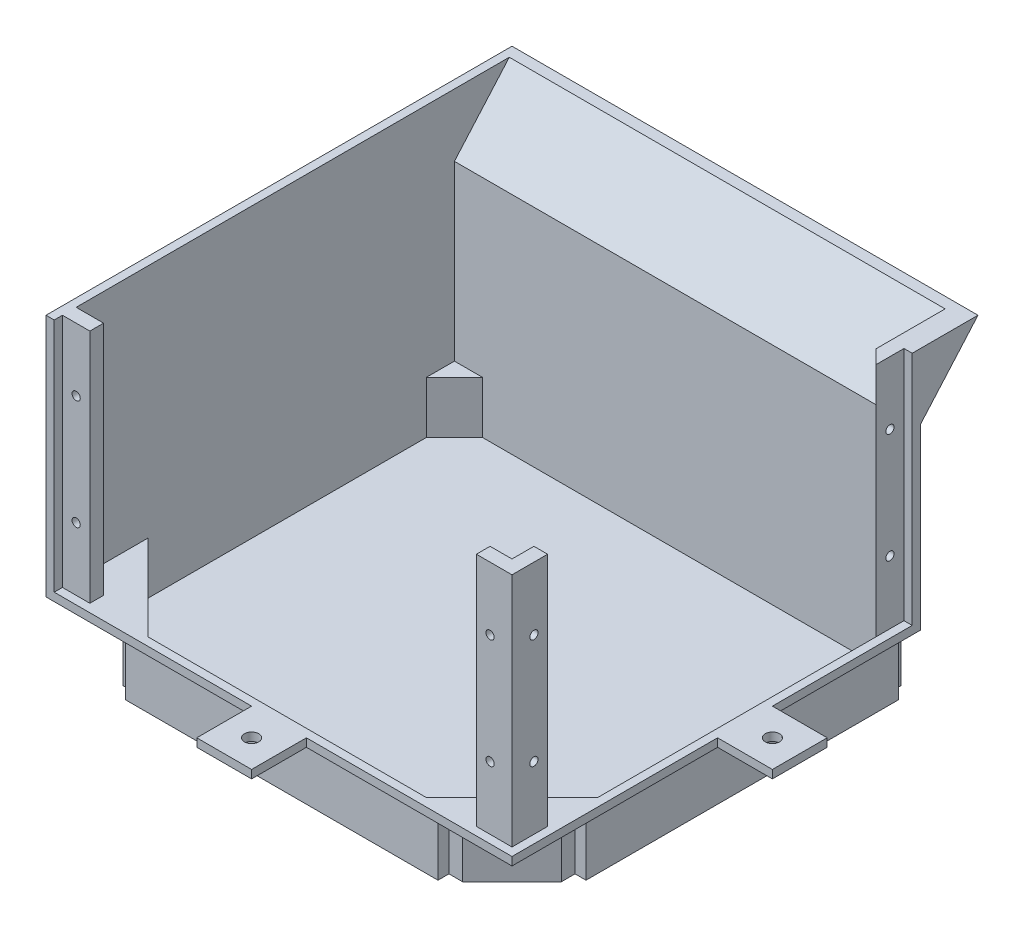
from build123d import *

# Parameters (mm, degrees)
EXTRUDE_1_DEPTH      = 4
EXTRUDE_2_DEPTH      = 16
SKETCH_3_W           = 170
SKETCH_3_H           = 170
CUT_EXTRUDE_2_DEPTH  = 1
EXTRUDE_3_DEPTH      = 3
EXTRUDE_4_DEPTH      = 86
SKETCH_7_W           = 10
SKETCH_7_H           = 3
SKETCH_7_W_2         = 3
SKETCH_7_H_2         = 10
EXTRUDE_6_DEPTH      = 86
SKETCH_8_R           = 1.5
CUT_EXTRUDE_3_DEPTH  = 86
SKETCH_9_R           = 1.606229087
SKETCH_9_R_2         = 2.055519853
CUT_EXTRUDE_4_DEPTH  = 86
SKETCH_10_W          = 3
SKETCH_10_H          = 3
EXTRUDE_7_DEPTH      = 86
SKETCH_11_R          = 1.5
CUT_EXTRUDE_5_DEPTH  = 86
EXTRUDE_8_DEPTH      = 86
SKETCH_13_R          = 1.5
CUT_EXTRUDE_6_DEPTH  = 86
SKETCH_14_R          = 3
CUT_EXTRUDE_7_DEPTH  = 2
SKETCH_15_R          = 1.5
CUT_EXTRUDE_8_DEPTH  = 5
SKETCH_16_R          = 3
CUT_EXTRUDE_9_DEPTH  = 2
SKETCH_17_W          = 10
SKETCH_17_H          = 2
SKETCH_17_W_2        = 2
SKETCH_17_H_2        = 10
EXTRUDE_9_DEPTH      = 86
SKETCH_18_R          = 3
CUT_EXTRUDE_10_DEPTH = 2
SKETCH_19_R          = 3
CUT_EXTRUDE_11_DEPTH = 2
SKETCH_22_W          = 20
SKETCH_22_H          = 20
SKETCH_22_R          = 2.6
EXTRUDE_10_DEPTH     = 3
SKETCH_23_W          = 170
SKETCH_23_H          = 20
CUT_EXTRUDE_12_DEPTH = 100
SKETCH_25_W          = 167
SKETCH_25_H          = 3
EXTRUDE_11_DEPTH     = 105
CUT_EXTRUDE_14_DEPTH = 19
SKETCH_28_W          = 114
SKETCH_28_H          = 1
SKETCH_28_W_2        = 1
SKETCH_28_H_2        = 114
CUT_EXTRUDE_15_DEPTH = 19
EXTRUDE_12_DEPTH     = 90
SKETCH_32_W          = 170
SKETCH_32_H          = 1
CUT_EXTRUDE_18_DEPTH = 100
CUT_EXTRUDE_19_DEPTH = 5
SKETCH_34_W          = 159
SKETCH_34_H          = 1
SKETCH_34_W_2        = 3
EXTRUDE_13_DEPTH     = 105
SKETCH_35_W          = 5
SKETCH_35_H          = 5
CUT_EXTRUDE_20_DEPTH = 16
SKETCH_36_W          = 2
SKETCH_36_H          = 1
CUT_EXTRUDE_21_DEPTH = 16
SKETCH_37_R          = 1.5
CUT_EXTRUDE_22_DEPTH = 16
SKETCH_38_R          = 3
CUT_EXTRUDE_23_DEPTH = 2
EXTRUDE_14_DEPTH     = 170
CUT_EXTRUDE_24_DEPTH = 167
EXTRUDE_15_DEPTH     = 8


with BuildPart() as part:
    # 草图1 → 凸台-拉伸1 (new body)
    with BuildSketch(Plane(origin=(0, 0, 0), x_dir=(1, 0, 0), z_dir=(0, 1, 0))):
        Polygon((-80, 62), (-62, 80), (-57, 80), (-57, 85), (57, 85), (57, 80), (62, 80), (80, 62), (80, 57), (85, 57), (85, -57), (80, -57), (80, -62), (62, -80), (57, -80), (57, -85), (-57, -85), (-57, -80), (-62, -80), (-80, -62), (-80, -57), (-85, -57), (-85, 57), (-80, 57), align=None)
    extrude(amount=EXTRUDE_1_DEPTH)

    # 草图2 → 凸台-拉伸2 (add)
    with BuildSketch(Plane(origin=(0, 4, 0), x_dir=(1, 0, 0), z_dir=(0, 1, 0))):
        Polygon((-57, 85), (57, 85), (57, 80), (62, 80), (80, 62), (80, 57), (85, 57), (85, -57), (80, -57), (80, -62), (62, -80), (57, -80), (57, -85), (-57, -85), (-57, -80), (-62, -80), (-80, -62), (-80, -57), (-85, -57), (-85, 57), (-80, 57), (-80, 62), (-62, 80), (-57, 80), align=None)
        Polygon((-82, 50.757359313), (-50.757359313, 82), (50.757359313, 82), (82, 50.757359313), (82, -50.757359313), (50.757359313, -82), (-50.757359313, -82), (-82, -50.757359313), align=None, mode=Mode.SUBTRACT)
    extrude(amount=EXTRUDE_2_DEPTH)

    # 草图3 → 切除-拉伸2 (cut)
    with BuildSketch(Plane(origin=(0, 0, 0), x_dir=(-1, 0, 0), z_dir=(0, -1, 0))):
        Rectangle(SKETCH_3_W, SKETCH_3_H)
    extrude(amount=-CUT_EXTRUDE_2_DEPTH, mode=Mode.SUBTRACT)

    # 草图4 → 凸台-拉伸3 (add)
    with BuildSketch(Plane(origin=(0, 20, 0), x_dir=(1, 0, 0), z_dir=(0, 1, 0))):
        Polygon((85, 85), (-57, 85), (-85, 85), (-85, -85), (57, -85), (85, -85), align=None)
        Polygon((82, 50.757359313), (82, -50.757359313), (50.757359313, -82), (-50.757359313, -82), (-82, -50.757359313), (-82, 50.757359313), (-50.757359313, 82), (50.757359313, 82), align=None, mode=Mode.SUBTRACT)
    extrude(amount=EXTRUDE_3_DEPTH)

    # 草图5 → 凸台-拉伸4 (add)
    with BuildSketch(Plane(origin=(0, 23, 0), x_dir=(1, 0, 0), z_dir=(0, 1, 0))):
        Polygon((85, 85), (-85, 85), (-85, -85), (-82, -85), (-82, 82), (85, 82), align=None)
    extrude(amount=EXTRUDE_4_DEPTH)

    # 草图7 → 凸台-拉伸6 (add)
    with BuildSketch(Plane(origin=(0, 23, 0), x_dir=(1, 0, 0), z_dir=(0, 1, 0))):
        with Locations((-77, -80.5)):
            Rectangle(SKETCH_7_W, SKETCH_7_H)
        with Locations((80.5, 77)):
            Rectangle(SKETCH_7_W_2, SKETCH_7_H_2)
        Polygon((72, -79), (72, -82), (82, -82), (82, -72), (79, -72), (79, -79), align=None)
    extrude(amount=EXTRUDE_6_DEPTH)

    # 草图8 → 切除-拉伸3 (cut)
    with BuildSketch(Plane.XY.offset(82)):
        with Locations((-77, 86)):
            Circle(SKETCH_8_R)
        with Locations((-77, 46)):
            Circle(SKETCH_8_R)
    extrude(amount=-CUT_EXTRUDE_3_DEPTH, mode=Mode.SUBTRACT)

    # 草图9 → 切除-拉伸4 (cut)
    with BuildSketch(Plane(origin=(82, 0, 0), x_dir=(0, 0, -1), z_dir=(1, 0, 0))):
        with Locations((77, 86)):
            Circle(SKETCH_9_R)
        with Locations((77, 46)):
            Circle(SKETCH_9_R_2)
    extrude(amount=-CUT_EXTRUDE_4_DEPTH, mode=Mode.SUBTRACT)

    # 草图10 → 凸台-拉伸7 (add)
    with BuildSketch(Plane(origin=(0, 109, 0), x_dir=(1, 0, 0), z_dir=(0, 1, 0))):
        with Locations((80.5, -70.5)):
            Rectangle(SKETCH_10_W, SKETCH_10_H)
        with Locations((70.5, -80.5)):
            Rectangle(SKETCH_10_W, SKETCH_10_H)
    extrude(amount=-EXTRUDE_7_DEPTH)

    # 草图11 → 切除-拉伸5 (cut)
    with BuildSketch(Plane.XY.offset(82)):
        with Locations((74, 86)):
            Circle(SKETCH_11_R)
        with Locations((74, 46)):
            Circle(SKETCH_11_R)
    extrude(amount=-CUT_EXTRUDE_5_DEPTH, mode=Mode.SUBTRACT)

    # 草图12 → 凸台-拉伸8 (add)
    with BuildSketch(Plane(origin=(0, 109, 0), x_dir=(1, 0, 0), z_dir=(0, 1, 0))):
        Polygon((69, -77), (69, -79), (79, -79), (79, -69), (77, -69), (77, -77), align=None)
    extrude(amount=-EXTRUDE_8_DEPTH)

    # 草图13 → 切除-拉伸6 (cut)
    with BuildSketch(Plane.XY.offset(82)):
        with Locations((74, 86)):
            Circle(SKETCH_13_R)
        with Locations((74, 46)):
            Circle(SKETCH_13_R)
    extrude(amount=-CUT_EXTRUDE_6_DEPTH, mode=Mode.SUBTRACT)

    # 草图14 → 切除-拉伸7 (cut)
    with BuildSketch(Plane(origin=(0, 0, 77), x_dir=(-1, 0, 0), z_dir=(0, 0, -1))):
        with Locations((-74, 86)):
            Circle(SKETCH_14_R)
        with Locations((-74, 46)):
            Circle(SKETCH_14_R)
    extrude(amount=-CUT_EXTRUDE_7_DEPTH, mode=Mode.SUBTRACT)

    # 草图15 → 切除-拉伸8 (cut)
    with BuildSketch(Plane(origin=(82, 0, 0), x_dir=(0, 0, -1), z_dir=(1, 0, 0))):
        with Locations((-74, 86)):
            Circle(SKETCH_15_R)
        with Locations((-74, 46)):
            Circle(SKETCH_15_R)
    extrude(amount=-CUT_EXTRUDE_8_DEPTH, mode=Mode.SUBTRACT)

    # 草图16 → 切除-拉伸9 (cut)
    with BuildSketch(Plane.ZY.offset(-77)):
        with Locations((74, 86)):
            Circle(SKETCH_16_R)
        with Locations((74, 46)):
            Circle(SKETCH_16_R)
    extrude(amount=-CUT_EXTRUDE_9_DEPTH, mode=Mode.SUBTRACT)

    # 草图17 → 凸台-拉伸9 (add)
    with BuildSketch(Plane(origin=(0, 109, 0), x_dir=(1, 0, 0), z_dir=(0, 1, 0))):
        with Locations((-77, -78)):
            Rectangle(SKETCH_17_W, SKETCH_17_H)
        with Locations((78, 77)):
            Rectangle(SKETCH_17_W_2, SKETCH_17_H_2)
    extrude(amount=-EXTRUDE_9_DEPTH)

    # 草图18 → 切除-拉伸10 (cut)
    with BuildSketch(Plane.ZY.offset(-77)):
        with Locations((-77, 86)):
            Circle(SKETCH_18_R)
        with Locations((-77, 46)):
            Circle(SKETCH_18_R)
    extrude(amount=-CUT_EXTRUDE_10_DEPTH, mode=Mode.SUBTRACT)

    # 草图19 → 切除-拉伸11 (cut)
    with BuildSketch(Plane(origin=(0, 0, 77), x_dir=(-1, 0, 0), z_dir=(0, 0, -1))):
        with Locations((77, 86)):
            Circle(SKETCH_19_R)
        with Locations((77, 46)):
            Circle(SKETCH_19_R)
    extrude(amount=-CUT_EXTRUDE_11_DEPTH, mode=Mode.SUBTRACT)

    # 草图22 → 凸台-拉伸10 (add)
    # profile 1 of 3: a face of its own
    with BuildSketch(Plane(origin=(0, 23, 0), x_dir=(1, 0, 0), z_dir=(0, 1, 0))):
        with Locations((-95, 10)):
            Rectangle(SKETCH_22_W, SKETCH_22_H)
        with Locations((-95, 10)):
            Circle(SKETCH_22_R, mode=Mode.SUBTRACT)
    # profile 2 of 3: a face of its own
    with BuildSketch(Plane(origin=(0, 23, 0), x_dir=(1, 0, 0), z_dir=(0, 1, 0))):
        with Locations((95, 0)):
            Rectangle(SKETCH_22_W, SKETCH_22_H)
        with Locations((95, 0)):
            Circle(SKETCH_22_R, mode=Mode.SUBTRACT)
    # profile 3 of 3: a face of its own
    with BuildSketch(Plane(origin=(0, 23, 0), x_dir=(1, 0, 0), z_dir=(0, 1, 0))):
        with Locations((0, -95)):
            Rectangle(SKETCH_22_W, SKETCH_22_H)
        with Locations((0, -95)):
            Circle(SKETCH_22_R, mode=Mode.SUBTRACT)
    extrude(amount=-EXTRUDE_10_DEPTH)

    # 草图23 → 切除-拉伸12 (cut)
    with BuildSketch(Plane(origin=(0, 109, 0), x_dir=(1, 0, 0), z_dir=(0, 1, 0))):
        with Locations((0, 75)):
            Rectangle(SKETCH_23_W, SKETCH_23_H)
    extrude(amount=-CUT_EXTRUDE_12_DEPTH, mode=Mode.SUBTRACT)

    # 草图25 → 凸台-拉伸11 (add)
    with BuildSketch(Plane(origin=(0, 4, 0), x_dir=(1, 0, 0), z_dir=(0, 1, 0))):
        with Locations((1.5, 63.5)):
            Rectangle(SKETCH_25_W, SKETCH_25_H)
    extrude(amount=EXTRUDE_11_DEPTH)

    # 草图26 → 切除-拉伸14 (cut)
    with BuildSketch(Plane.XZ.offset(-1)):
        Polygon((80, -65), (77, -65), (80, -62), (85, -62), (85, -65), align=None)
        Polygon((-82, -62), (-80, -62), (-77, -65), (-80, -65), (-82, -65), align=None)
    extrude(amount=-CUT_EXTRUDE_14_DEPTH, mode=Mode.SUBTRACT)

    # 草图28 → 切除-拉伸15 (cut)
    with BuildSketch(Plane.XZ.offset(-1)):
        with Locations((0, 84.5)):
            Rectangle(SKETCH_28_W, SKETCH_28_H)
        with Locations((84.5, 0)):
            Rectangle(SKETCH_28_W_2, SKETCH_28_H_2)
        with Locations((0, -84.5)):
            Rectangle(SKETCH_28_W, SKETCH_28_H)
        with Locations((-84.5, 0)):
            Rectangle(SKETCH_28_W_2, SKETCH_28_H_2)
    extrude(amount=-CUT_EXTRUDE_15_DEPTH, mode=Mode.SUBTRACT)

    # 草图29 → 凸台-拉伸12 (add)
    with BuildSketch(Plane(origin=(0, 109, 0), x_dir=(1, 0, 0), z_dir=(0, 1, 0))):
        Polygon((82, 50.757359313), (82, 62), (79, 62), (77, 62), (77, 55.757359313), (79, 53.757359313), align=None)
    extrude(amount=-EXTRUDE_12_DEPTH)

    # 草图32 → 切除-拉伸18 (cut)
    with BuildSketch(Plane(origin=(0, 109, 0), x_dir=(1, 0, 0), z_dir=(0, 1, 0))):
        with Locations((0, 64.5)):
            Rectangle(SKETCH_32_W, SKETCH_32_H)
    extrude(amount=-CUT_EXTRUDE_18_DEPTH, mode=Mode.SUBTRACT)

    # 草图33 → 切除-拉伸19 (cut)
    with BuildSketch(Plane(origin=(0, 9, 0), x_dir=(1, 0, 0), z_dir=(0, 1, 0))):
        Polygon((67.757359313, 65), (-67.757359313, 65), (-68.757359313, 64), (67.757359313, 64), (68.757359313, 64), align=None)
    extrude(amount=-CUT_EXTRUDE_19_DEPTH, mode=Mode.SUBTRACT)

    # 草图34 → 凸台-拉伸13 (add)
    with BuildSketch(Plane(origin=(0, 109, 0), x_dir=(1, 0, 0), z_dir=(0, 1, 0))):
        with Locations((-2.5, 61.5)):
            Rectangle(SKETCH_34_W, SKETCH_34_H)
        with Locations((83.5, 61.5)):
            Rectangle(SKETCH_34_W_2, SKETCH_34_H)
    extrude(amount=-EXTRUDE_13_DEPTH)

    # 草图35 → 切除-拉伸20 (cut)
    with BuildSketch(Plane(origin=(0, 4, 0), x_dir=(-1, 0, 0), z_dir=(0, -1, 0))):
        with Locations((-82.5, 59.5)):
            Rectangle(SKETCH_35_W, SKETCH_35_H)
    extrude(amount=-CUT_EXTRUDE_20_DEPTH, mode=Mode.SUBTRACT)

    # 草图36 → 切除-拉伸21 (cut)
    with BuildSketch(Plane.XZ.offset(-4)):
        with Locations((-81, -61.5)):
            Rectangle(SKETCH_36_W, SKETCH_36_H)
    extrude(amount=-CUT_EXTRUDE_21_DEPTH, mode=Mode.SUBTRACT)

    # 草图37 → 切除-拉伸22 (cut)
    with BuildSketch(Plane(origin=(82, 0, 0), x_dir=(0, 0, -1), z_dir=(1, 0, 0))):
        with Locations((55.878679656, 46)):
            Circle(SKETCH_37_R)
        with Locations((55.878679656, 86)):
            Circle(SKETCH_37_R)
    extrude(amount=-CUT_EXTRUDE_22_DEPTH, mode=Mode.SUBTRACT)

    # 草图38 → 切除-拉伸23 (cut)
    with BuildSketch(Plane.ZY.offset(-77)):
        with Locations((-55.878679656, 86)):
            Circle(SKETCH_38_R)
        with Locations((-55.878679656, 46)):
            Circle(SKETCH_38_R)
    extrude(amount=-CUT_EXTRUDE_23_DEPTH, mode=Mode.SUBTRACT)

    # 草图39 → 凸台-拉伸14 (add)
    with BuildSketch(Plane(origin=(85, 0, 0), x_dir=(0, 0, -1), z_dir=(1, 0, 0))):
        Polygon((64, 109), (85, 109), (64, 85), align=None)
    extrude(amount=-EXTRUDE_14_DEPTH)

    # 草图40 → 切除-拉伸24 (cut)
    with BuildSketch(Plane(origin=(85, 0, 0), x_dir=(0, 0, -1), z_dir=(1, 0, 0))):
        Polygon((61, 109), (81.01369532, 109), (61, 86.127205348), align=None)
    extrude(amount=-CUT_EXTRUDE_24_DEPTH, mode=Mode.SUBTRACT)

    # 草图41 → 凸台-拉伸15 (add)
    with BuildSketch(Plane(origin=(85, 0, 0), x_dir=(0, 0, -1), z_dir=(1, 0, 0))):
        Polygon((61, 86.127205348), (61, 109), (81.01369532, 109), align=None)
    extrude(amount=-EXTRUDE_15_DEPTH)


solid = part.part
